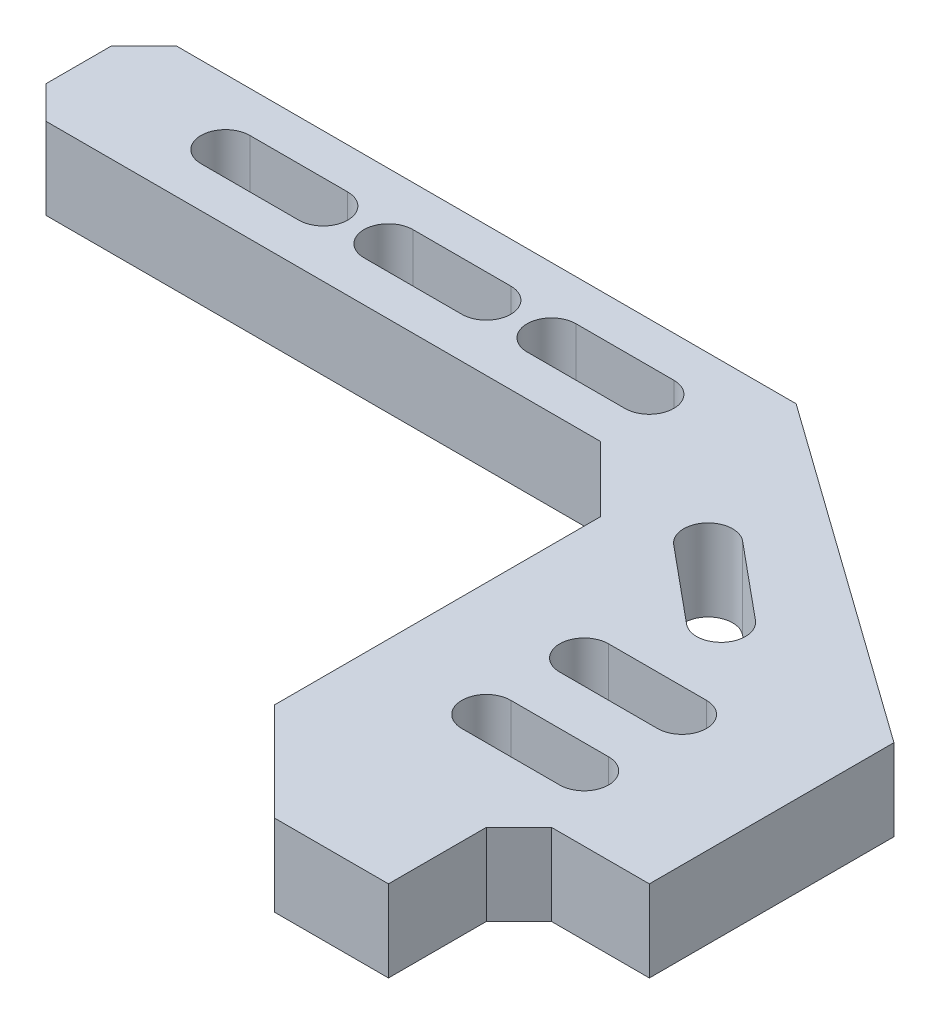
from build123d import *

# Parameters (mm, degrees)
BOSS_EXTRUDE1_DEPTH = 5
CHAMFER1_SIZE       = 2
CHAMFER2_SIZE       = 6
CHAMFER3_SIZE       = 4


with BuildPart() as part:
    # Sketch2 → Boss-Extrude1 (new body)
    with BuildSketch(Plane(origin=(0, 0, 0), x_dir=(1, 0, 0), z_dir=(0, 1, 0))):
        Polygon((40.026305405, 0), (0.026305405, 0), (0.026305405, -8), (40.026305405, -8), (40.026305405, -38), (53.026305405, -38), (53.026305405, -32), (55.026305405, -30), (61.026305405, -30), (61.026305405, -15), align=None)
        with BuildLine():
            ThreePointArc((47.026305405, -27.5), (45.526305405, -26), (47.026305405, -24.5))
            Line((47.026305405, -24.5), (53.026305405, -24.5))
            ThreePointArc((53.026305405, -24.5), (54.526305405, -26), (53.026305405, -27.5))
            Line((53.026305405, -27.5), (47.026305405, -27.5))
        make_face(mode=Mode.SUBTRACT)
        with BuildLine():
            ThreePointArc((47.026305405, -21.5), (45.526305405, -20), (47.026305405, -18.5))
            Line((47.026305405, -18.5), (53.026305405, -18.5))
            ThreePointArc((53.026305405, -18.5), (54.526305405, -20), (53.026305405, -21.5))
            Line((53.026305405, -21.5), (47.026305405, -21.5))
        make_face(mode=Mode.SUBTRACT)
        with BuildLine():
            ThreePointArc((9.026305405, -5.5), (7.526305405, -4), (9.026305405, -2.5))
            Line((9.026305405, -2.5), (15.026305405, -2.5))
            ThreePointArc((15.026305405, -2.5), (16.526305405, -4), (15.026305405, -5.5))
            Line((15.026305405, -5.5), (9.026305405, -5.5))
        make_face(mode=Mode.SUBTRACT)
        with BuildLine():
            ThreePointArc((19.026305405, -5.5), (17.526305405, -4), (19.026305405, -2.5))
            Line((19.026305405, -2.5), (25.026305405, -2.5))
            ThreePointArc((25.026305405, -2.5), (26.526305405, -4), (25.026305405, -5.5))
            Line((25.026305405, -5.5), (19.026305405, -5.5))
        make_face(mode=Mode.SUBTRACT)
        with BuildLine():
            ThreePointArc((43.759423492, -11.240077261), (43.562000753, -9.127963566), (45.674114448, -8.930540827))
            Line((45.674114448, -8.930540827), (50.293187317, -12.759922739))
            ThreePointArc((50.293187317, -12.759922739), (50.490610056, -14.872036434), (48.378496361, -15.069459173))
            Line((48.378496361, -15.069459173), (43.759423492, -11.240077261))
        make_face(mode=Mode.SUBTRACT)
        with BuildLine():
            ThreePointArc((29.026305405, -5.5), (27.526305405, -4), (29.026305405, -2.5))
            Line((29.026305405, -2.5), (35.026305405, -2.5))
            ThreePointArc((35.026305405, -2.5), (36.526305405, -4), (35.026305405, -5.5))
            Line((35.026305405, -5.5), (29.026305405, -5.5))
        make_face(mode=Mode.SUBTRACT)
    extrude(amount=BOSS_EXTRUDE1_DEPTH)

    # Chamfer1
    chamfer1_edges = [part.edges().sort_by_distance(p)[0] for p in [
        (0.026305405, 2.5, 8),
        (0.026305405, 2.5, 0),
    ]]
    chamfer(chamfer1_edges, length=CHAMFER1_SIZE)

    # Chamfer2
    chamfer2_edges = [part.edges().sort_by_distance(p)[0] for p in [
        (40.026305405, 2.5, 38),
    ]]
    chamfer(chamfer2_edges, length=CHAMFER2_SIZE)

    # Chamfer3
    chamfer3_edges = [part.edges().sort_by_distance(p)[0] for p in [
        (40.026305405, 2.5, 8),
    ]]
    chamfer(chamfer3_edges, length=CHAMFER3_SIZE)


solid = part.part
